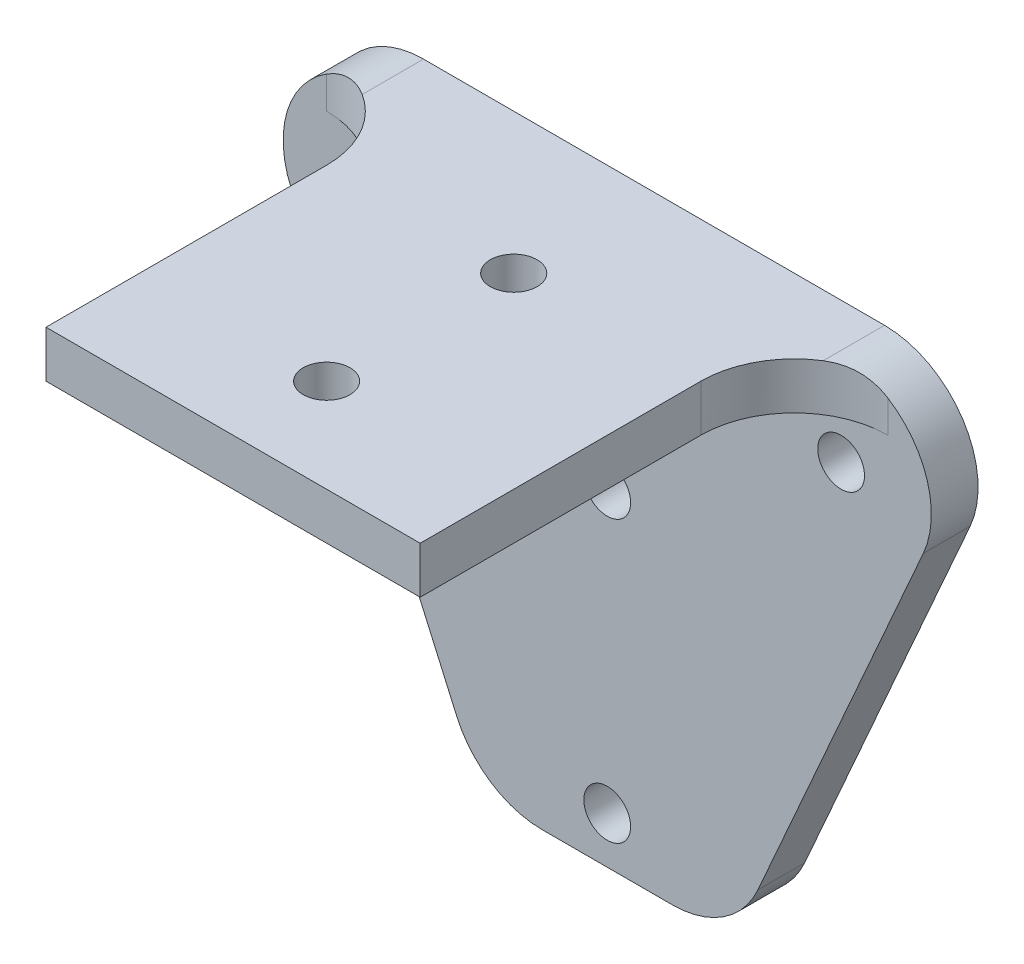
from build123d import *

# Parameters (mm, degrees)
SKETCH1_R               = 2.5
BOSS_EXTRUDE1_DEPTH     = 5
FILLET1_R               = 10
SKETCH2_W               = 40
SKETCH2_H               = 5
BOSS_EXTRUDE2_DEPTH     = 40
SKETCH3_R               = 2.5
CUT_EXTRUDE1_DEPTH      = 106.814430788
FILLET3_R               = 10
SKETCH4_W               = 2
SKETCH4_H               = 7
BOSS_EXTRUDE3_DEPTH     = 8
CUT_EXTRUDE2_DEPTH      = 109.89140498
CUT_EXTRUDE2_DEPTH_BACK = 109.89140498
SKETCH5_W               = 6
SKETCH5_H               = 5


with BuildPart() as part:
    # Sketch1 → Boss-Extrude1 (new body)
    with BuildSketch(Plane.XY):
        Polygon((0, 90), (80, 90), (53.46739399, 30), (26.53260601, 30), align=None)
        with Locations((15, 80)):
            Circle(SKETCH1_R, mode=Mode.SUBTRACT)
        with Locations((65, 80)):
            Circle(SKETCH1_R, mode=Mode.SUBTRACT)
        with Locations((40, 35)):
            Circle(SKETCH1_R, mode=Mode.SUBTRACT)
        with Locations((40, 65)):
            Circle(SKETCH1_R, mode=Mode.SUBTRACT)
    extrude(amount=BOSS_EXTRUDE1_DEPTH)

    # Fillet1
    fillet1_edges = [part.edges().sort_by_distance(p)[0] for p in [
        (0, 90, 2.5),
        (80, 90, 2.5),
        (53.46739399, 30, 2.5),
        (26.53260601, 30, 2.5),
    ]]
    fillet(fillet1_edges, radius=FILLET1_R)

    # Sketch2 → Boss-Extrude2 (add)
    with BuildSketch(Plane.XY.offset(5)):
        with Locations((40, 87.5)):
            Rectangle(SKETCH2_W, SKETCH2_H)
    extrude(amount=BOSS_EXTRUDE2_DEPTH)

    # Sketch3 → Cut-Extrude1 (cut, through all)
    with BuildSketch(Plane(origin=(0, 90, 0), x_dir=(1, 0, 0), z_dir=(0, 1, 0))):
        with Locations(Location((40, -15, 0), (0, 0, 180))):
            Circle(SKETCH3_R)
        with Locations(Location((40, -35, 0), (0, 0, 180))):
            Circle(SKETCH3_R)
    extrude(amount=-CUT_EXTRUDE1_DEPTH, mode=Mode.SUBTRACT)

    # Fillet3
    fillet3_edges = [part.edges().sort_by_distance(p)[0] for p in [
        (60, 87.5, 5),
        (20, 87.5, 5),
    ]]
    fillet(fillet3_edges, radius=FILLET3_R)

    # Sketch4 → Boss-Extrude3 (add)
    with BuildSketch(Plane(origin=(0, 0, 0), x_dir=(-1, 0, 0), z_dir=(0, 0, -1))):
        with Locations((-34.022413797, 33.5)):
            Rectangle(SKETCH4_W, SKETCH4_H)
        with Locations((-45.977586203, 33.5)):
            Rectangle(SKETCH4_W, SKETCH4_H)
    extrude(amount=BOSS_EXTRUDE3_DEPTH)

    # Sketch5 → Cut-Extrude2 (cut, two sides: drawn at the far end of the back side and taken through both)
    with BuildSketch(Plane(origin=(46.977586203, 0, 0), x_dir=(0, 0, -1), z_dir=(1, 0, 0)).offset(-CUT_EXTRUDE2_DEPTH_BACK)):
        with Locations((4.124970421, 33.5)):
            Rectangle(SKETCH5_W, SKETCH5_H)
    extrude(amount=CUT_EXTRUDE2_DEPTH + CUT_EXTRUDE2_DEPTH_BACK, mode=Mode.SUBTRACT)


solid = part.part
